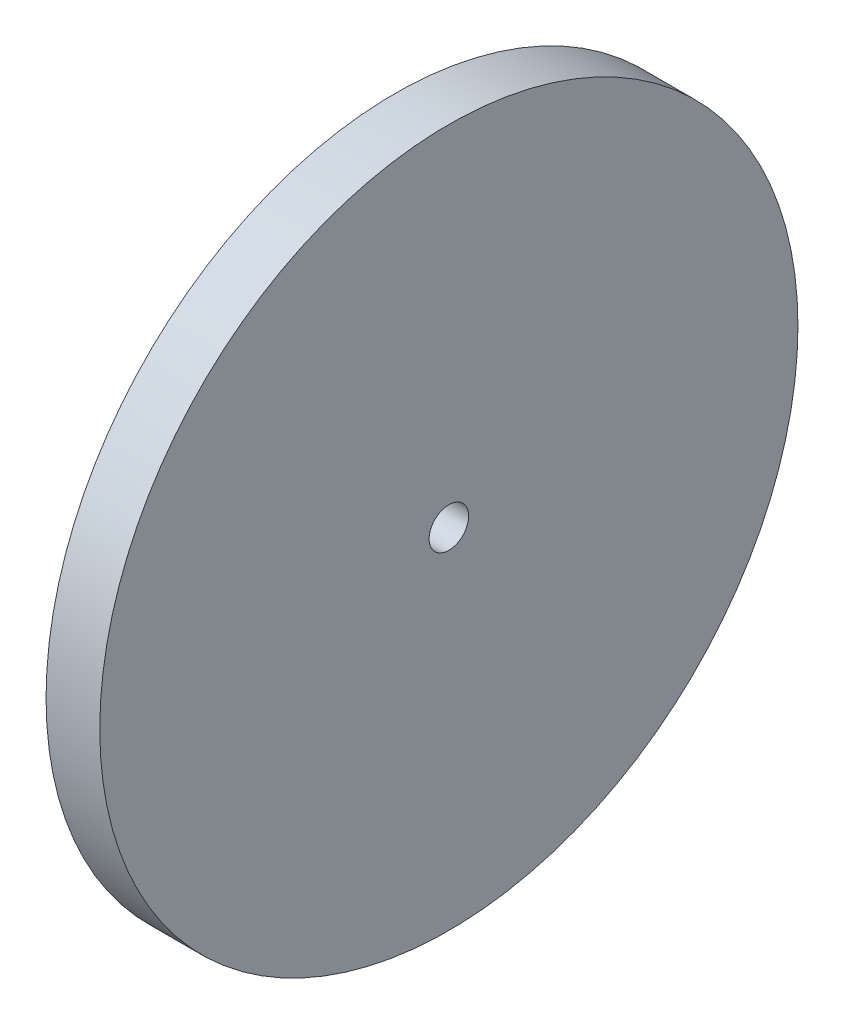
from build123d import *

# Parameters (mm, degrees)
SKETCH1_R           = 65
SKETCH1_R_2         = 3.675
BOSS_EXTRUDE1_DEPTH = 10


with BuildPart() as part:
    # Sketch1 → Boss-Extrude1 (new body)
    with BuildSketch(Plane(origin=(0, 0, 0), x_dir=(0, 0, -1), z_dir=(1, 0, 0))):
        Circle(SKETCH1_R)
        Circle(SKETCH1_R_2, mode=Mode.SUBTRACT)
    extrude(amount=BOSS_EXTRUDE1_DEPTH)


solid = part.part
